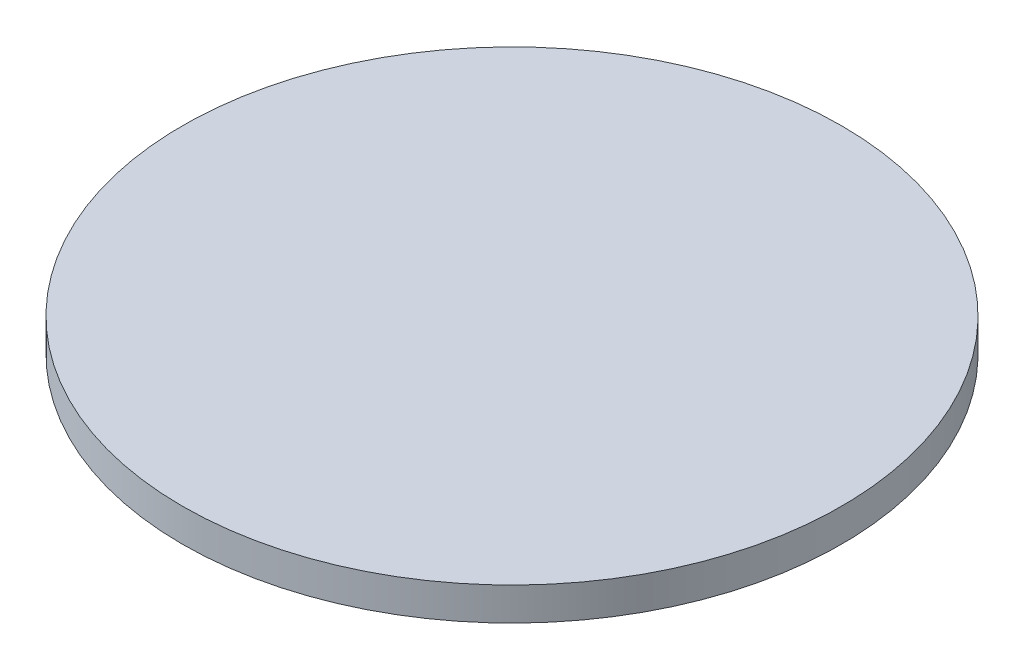
from build123d import *

# Parameters (mm, degrees)
SKETCH1_R           = 15
BOSS_EXTRUDE1_DEPTH = 1.5
SKETCH2_R           = 10
CUT_EXTRUDE1_DEPTH  = 0.5


with BuildPart() as part:
    # Sketch1 → Boss-Extrude1 (new body)
    with BuildSketch(Plane(origin=(0, 0, 0), x_dir=(1, 0, 0), z_dir=(0, 1, 0))):
        with Locations(Location((0, 0, 0), (0, 0, 270))):
            Circle(SKETCH1_R)
    extrude(amount=BOSS_EXTRUDE1_DEPTH)

    # Sketch2 → Cut-Extrude1 (cut)
    with BuildSketch(Plane.XZ):
        with Locations(Location((0, 0, 0), (0, 0, 270))):
            Circle(SKETCH2_R)
    extrude(amount=-CUT_EXTRUDE1_DEPTH, mode=Mode.SUBTRACT)


solid = part.part
